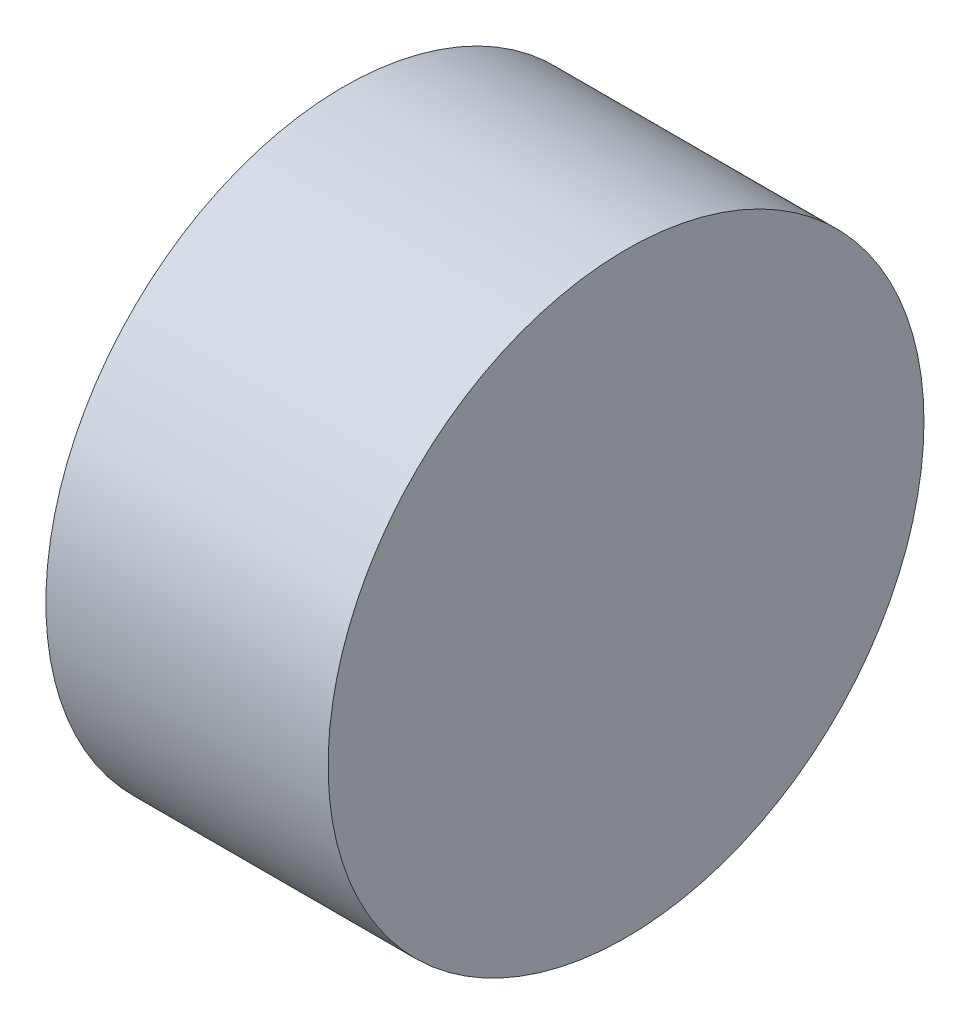
from build123d import *

# Parameters (mm, degrees)
SKETCH1_R           = 0.038
BOSS_EXTRUDE1_DEPTH = 0.036


with BuildPart() as part:
    # Sketch1 → Boss-Extrude1 (new body)
    with BuildSketch(Plane(origin=(0, 0, 0), x_dir=(0, 0, -1), z_dir=(1, 0, 0))):
        Circle(SKETCH1_R)
    extrude(amount=BOSS_EXTRUDE1_DEPTH)


solid = part.part
